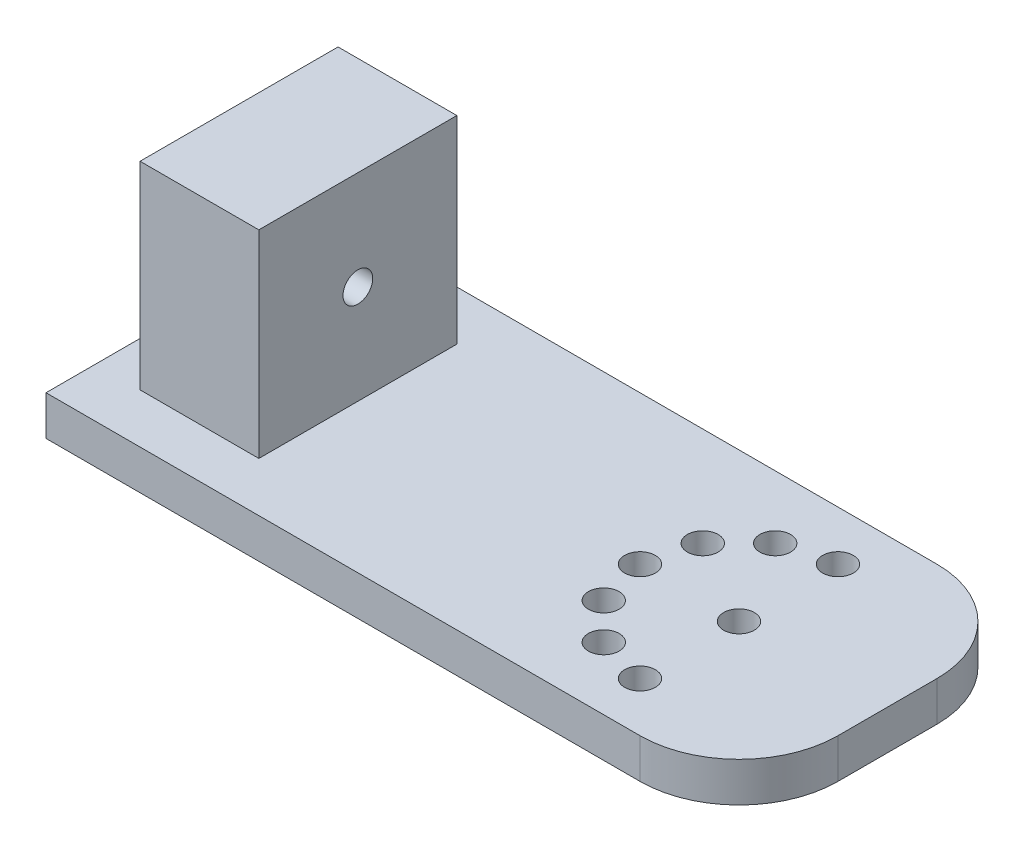
from build123d import *

# Parameters (mm, degrees)
SKETCH_1_W          = 70
SKETCH_1_H          = 30
EXTRUDE_1_DEPTH     = 4
SKETCH_2_W          = 12
SKETCH_2_H          = 20
EXTRUDE_2_DEPTH     = 20
SKETCH_7_R          = 1.5
CUT_EXTRUDE_2_DEPTH = 12
SKETCH_11_R         = 1.55
CUT_EXTRUDE_4_DEPTH = 50
FILLET_1_R          = 10
FILLET_2_R          = 10


with BuildPart() as part:
    # 草图1 → 凸台-拉伸1 (new body)
    with BuildSketch(Plane(origin=(0, 0, 0), x_dir=(1, 0, 0), z_dir=(0, 1, 0))):
        with Locations((35, -15)):
            Rectangle(SKETCH_1_W, SKETCH_1_H)
    extrude(amount=EXTRUDE_1_DEPTH)

    # 草图2 → 凸台-拉伸2 (add)
    with BuildSketch(Plane(origin=(0, 4, 0), x_dir=(1, 0, 0), z_dir=(0, 1, 0))):
        with Locations((10.5, -15)):
            Rectangle(SKETCH_2_W, SKETCH_2_H)
    extrude(amount=EXTRUDE_2_DEPTH)

    # 草图7 → 切除-拉伸2 (cut)
    with BuildSketch(Plane(origin=(16.5, 0, 0), x_dir=(0, 0, -1), z_dir=(1, 0, 0))):
        with Locations((-15, 14)):
            Circle(SKETCH_7_R)
    extrude(amount=-CUT_EXTRUDE_2_DEPTH, mode=Mode.SUBTRACT)

    # 草图11 → 切除-拉伸4 (cut)
    with BuildSketch(Plane(origin=(0, 4, 0), x_dir=(1, 0, 0), z_dir=(0, 1, 0))):
        with Locations(Location((55, -15, 0), (0, 0, 270))):
            Circle(SKETCH_11_R)
        with Locations(Location((50, -23.660254038, 0), (0, 0, 270))):
            Circle(SKETCH_11_R)
        with Locations(Location((46.339745962, -20, 0), (0, 0, 270))):
            Circle(SKETCH_11_R)
        with Locations(Location((46.339745962, -10, 0), (0, 0, 270))):
            Circle(SKETCH_11_R)
        with Locations(Location((50, -6.339745962, 0), (0, 0, 270))):
            Circle(SKETCH_11_R)
        with Locations(Location((45, -15, 0), (0, 0, 270))):
            Circle(SKETCH_11_R)
        with Locations(Location((55, -5, 0), (0, 0, 270))):
            Circle(SKETCH_11_R)
        with Locations(Location((55, -25, 0), (0, 0, 270))):
            Circle(SKETCH_11_R)
    extrude(amount=-CUT_EXTRUDE_4_DEPTH, mode=Mode.SUBTRACT)

    # 圆角1
    fillet_1_edges = [part.edges().sort_by_distance(p)[0] for p in [
        (70, 2, 30),
    ]]
    fillet(fillet_1_edges, radius=FILLET_1_R)

    # 圆角2
    fillet_2_edges = [part.edges().sort_by_distance(p)[0] for p in [
        (70, 2, 0),
    ]]
    fillet(fillet_2_edges, radius=FILLET_2_R)


solid = part.part
